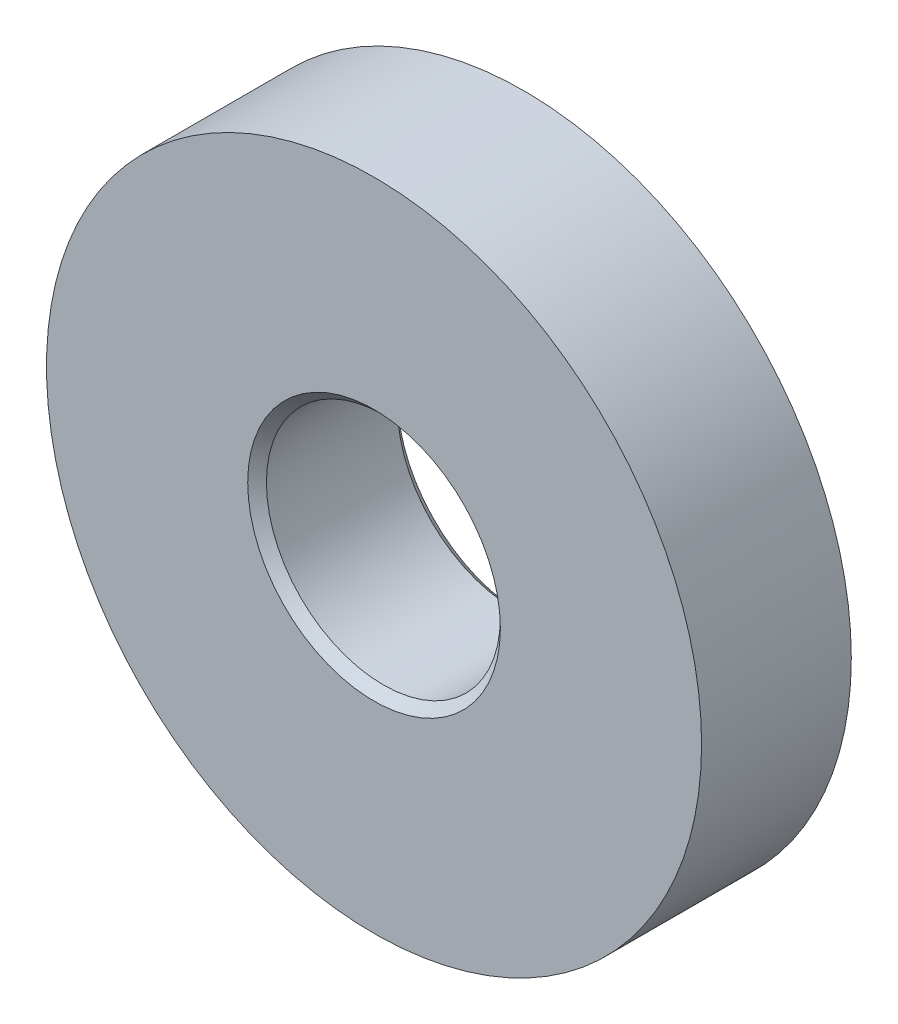
from build123d import *

# Parameters (mm, degrees)
SKETCH1_R           = 3.5
BOSS_EXTRUDE1_DEPTH = 1.6
SKETCH2_R           = 1.25
CUT_EXTRUDE1_DEPTH  = 6.201922721
CHAMFER1_SIZE       = 0.1


with BuildPart() as part:
    # Sketch1 → Boss-Extrude1 (new body)
    with BuildSketch(Plane.XY):
        Circle(SKETCH1_R)
    extrude(amount=-BOSS_EXTRUDE1_DEPTH)

    # Sketch2 → Cut-Extrude1 (cut, through all)
    with BuildSketch(Plane.XY):
        Circle(SKETCH2_R)
    extrude(amount=-CUT_EXTRUDE1_DEPTH, mode=Mode.SUBTRACT)

    # Chamfer1
    chamfer1_edges = [part.edges().sort_by_distance(p)[0] for p in [
        (-1.25, 0, -1.6),
        (-1.25, 0, 0),
    ]]
    chamfer(chamfer1_edges, length=CHAMFER1_SIZE)


solid = part.part
